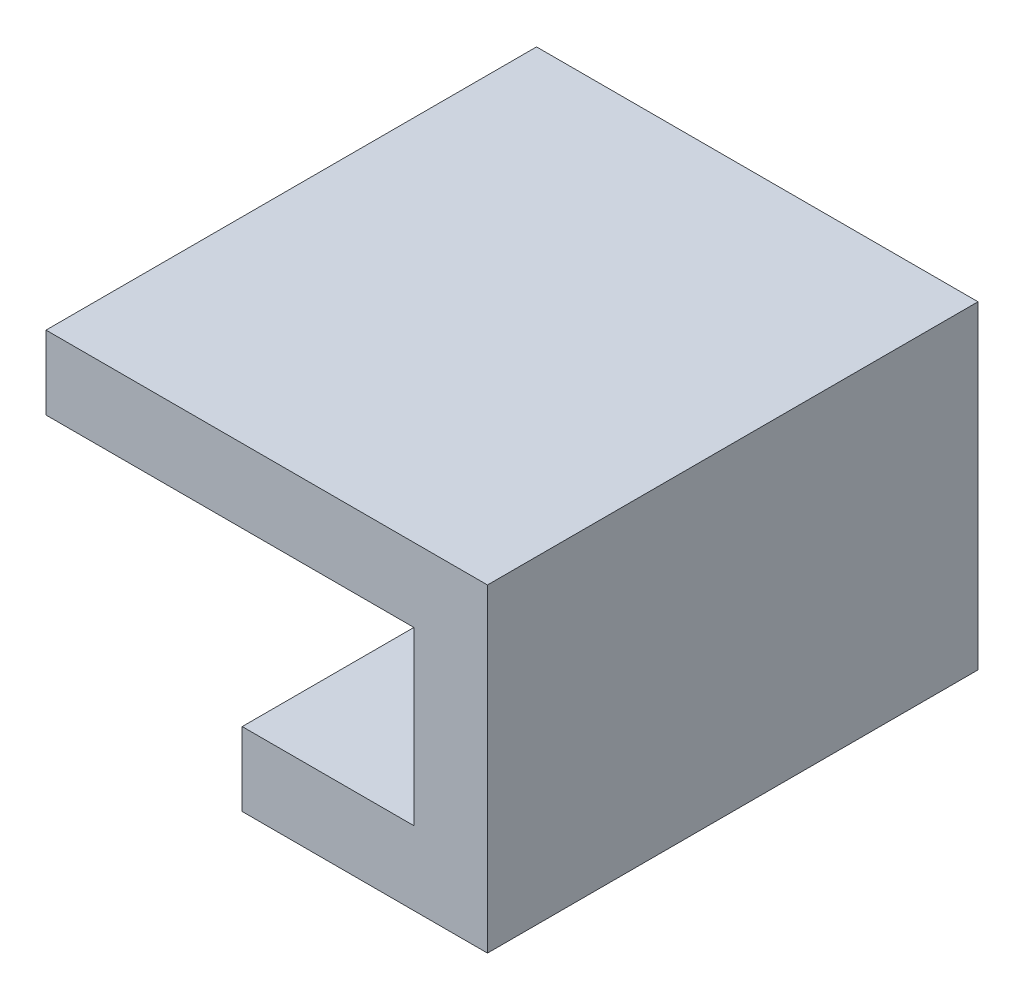
from build123d import *

# Parameters (mm, degrees)
BOSS_EXTRUDE1_DEPTH = 10


with BuildPart() as part:
    # Sketch1 → Boss-Extrude1 (new body)
    with BuildSketch(Plane.XY):
        Polygon((191.187130801, -62.311692807), (196.187130801, -62.311692807), (196.187130801, -55.811692807), (187.187130801, -55.811692807), (187.187130801, -57.311692807), (194.687130801, -57.311692807), (194.687130801, -60.811692807), (191.187130801, -60.811692807), align=None)
    extrude(amount=BOSS_EXTRUDE1_DEPTH)


solid = part.part
